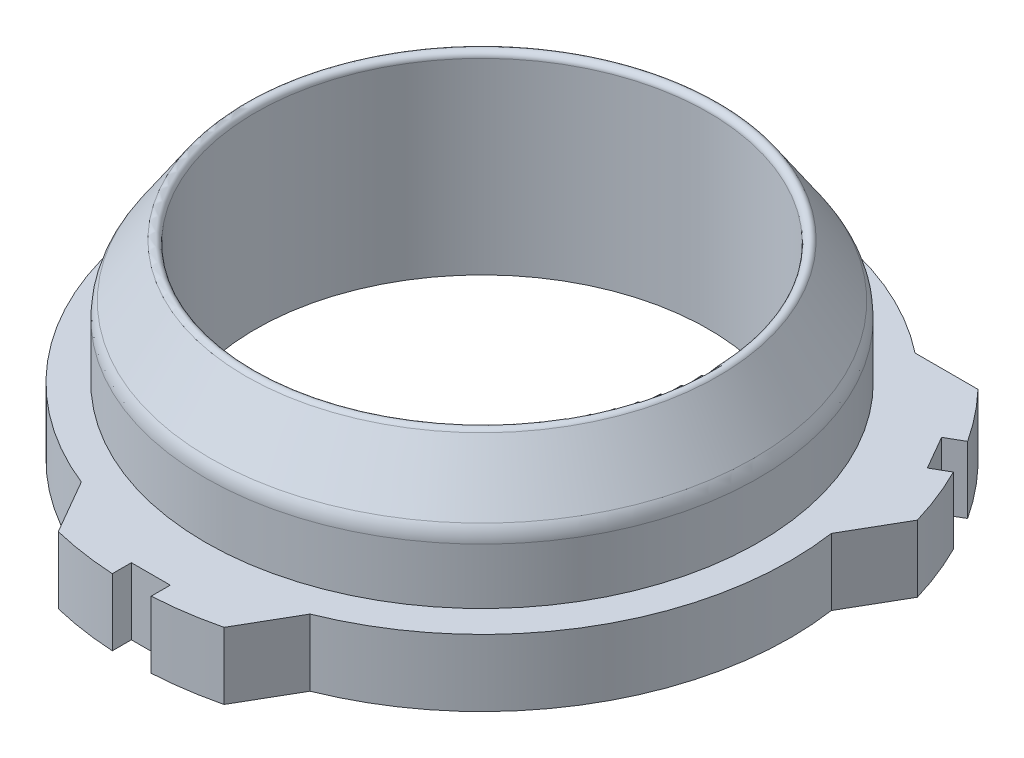
from build123d import *

# Parameters (mm, degrees)
SKETCH1_R           = 33.3375
SKETCH1_R_2         = 21.5265
BOSS_EXTRUDE1_DEPTH = 6.35
SKETCH5_R           = 39.889033067
CUT_EXTRUDE2_DEPTH  = 6.35
SKETCH6_W           = 3.697979252
SKETCH6_H           = 3.723099818
CUT_EXTRUDE3_DEPTH  = 6.35


with BuildPart() as part:
    # Sketch1 → Boss-Extrude1 (new body)
    with BuildSketch(Plane(origin=(0, 0, 0), x_dir=(1, 0, 0), z_dir=(0, 1, 0))):
        with Locations(Location((0, 0, 0), (0, 0, 270))):
            Circle(SKETCH1_R)
        with Locations(Location((0, 0, 0), (0, 0, 270))):
            Circle(SKETCH1_R_2, mode=Mode.SUBTRACT)
    extrude(amount=BOSS_EXTRUDE1_DEPTH)

    # Sketch2 → Revolve1 (revolve)
    with BuildSketch(Plane.XY, mode=Mode.PRIVATE) as revolve1_sk:
        with BuildLine():
            Line((21.5265, 6.35), (21.5265, 17.82357951))
            ThreePointArc((21.5265, 17.82357951), (21.885975678, 18.30938248), (22.455651676, 18.107648632))
            Line((22.455651676, 18.107648632), (25.85475838, 13.068243159))
            ThreePointArc((25.85475838, 13.068243159), (26.17801485, 12.390519163), (26.289, 11.647897552))
            Line((26.289, 11.647897552), (26.289, 6.35))
            Line((26.289, 6.35), (21.5265, 6.35))
        make_face()
    revolve(revolve1_sk.sketch.rotate(Axis((0, 21.224675992, 0), (0, -1, 0)), 90), axis=Axis((0, 21.224675992, 0), (0, -1, 0)))

    # Sketch5 → Cut-Extrude2 (cut)
    with BuildSketch(Plane(origin=(0, 0, 0), x_dir=(1, 0, 0), z_dir=(0, 1, 0))):
        Circle(SKETCH5_R)
        with BuildLine():
            Line((-24.11485133, 23.01875), (-18.134546198, 23.01875))
            ThreePointArc((-18.134546198, 23.01875), (0, 29.304003436), (18.134546198, 23.01875))
            Line((18.134546198, 23.01875), (24.11485133, 23.01875))
            ThreePointArc((24.11485133, 23.01875), (28.871121899, 16.66875), (31.992247929, 9.374698861))
            Line((31.992247929, 9.374698861), (29.002095362, 4.195602693))
            ThreePointArc((29.002095362, 4.195602693), (25.378011408, -14.652001718), (10.867549165, -27.214352693))
            Line((10.867549165, -27.214352693), (7.877396598, -32.393448861))
            ThreePointArc((7.877396598, -32.393448861), (0, -33.3375), (-7.877396598, -32.393448861))
            Line((-7.877396598, -32.393448861), (-10.867549165, -27.214352693))
            ThreePointArc((-10.867549165, -27.214352693), (-25.378011408, -14.652001718), (-29.002095362, 4.195602693))
            Line((-29.002095362, 4.195602693), (-31.992247929, 9.374698861))
            ThreePointArc((-31.992247929, 9.374698861), (-28.871121899, 16.66875), (-24.11485133, 23.01875))
        make_face(mode=Mode.SUBTRACT)
    extrude(amount=CUT_EXTRUDE2_DEPTH, mode=Mode.SUBTRACT)

    # Sketch6 → Cut-Extrude3 (cut)
    with BuildSketch(Plane(origin=(0, 0, 0), x_dir=(1, 0, 0), z_dir=(0, 1, 0))):
        Polygon((-28.1834672, 14.136703058), (-31.407766223, 15.998252967), (-29.558776597, 19.200796942), (-26.334477574, 17.339247033), align=None)
        with Locations((0, -33.3375)):
            Rectangle(SKETCH6_W, SKETCH6_H)
        Polygon((26.334477574, 17.339247033), (29.558776597, 19.200796942), (31.407766223, 15.998252967), (28.1834672, 14.136703058), align=None)
    extrude(amount=CUT_EXTRUDE3_DEPTH, mode=Mode.SUBTRACT)


solid = part.part
